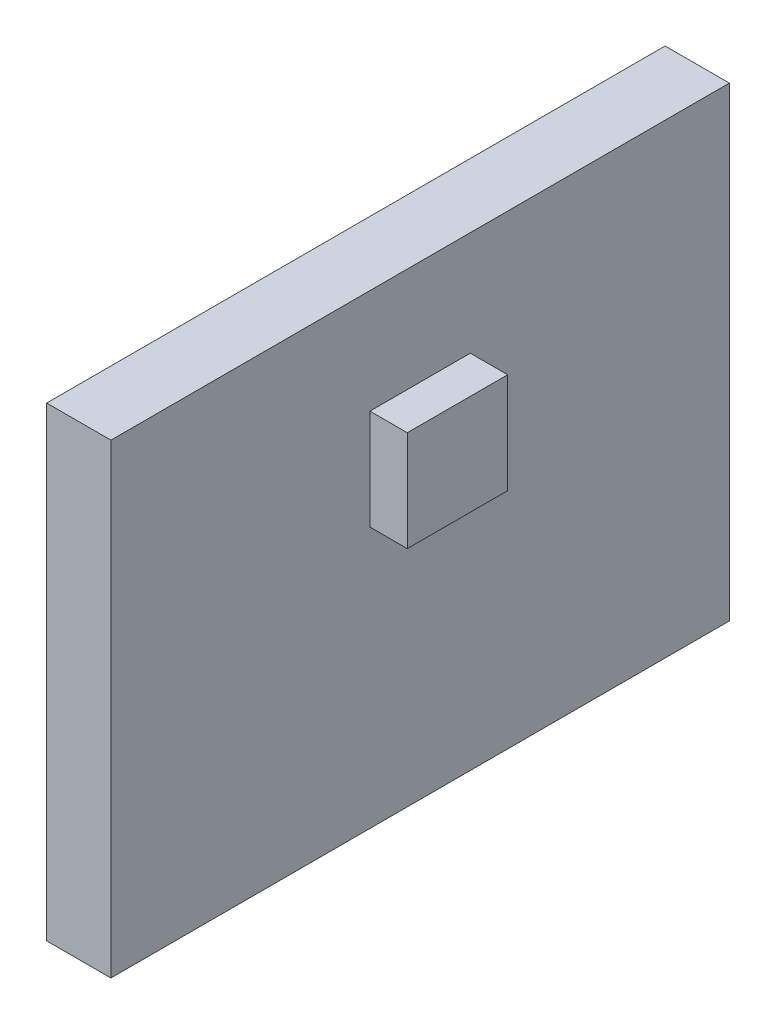
from build123d import *

# Parameters (mm, degrees)
SKETCH1_W           = 1.6
SKETCH1_H           = 11.6
BOSS_EXTRUDE1_DEPTH = 15.4
SKETCH2_W           = 0.93
SKETCH2_H           = 2.5
BOSS_EXTRUDE2_DEPTH = 2.5


with BuildPart() as part:
    # Sketch1 → Boss-Extrude1 (new body)
    with BuildSketch(Plane.XY.offset(18.3)):
        with Locations((-44, -126.7)):
            Rectangle(SKETCH1_W, SKETCH1_H)
    extrude(amount=BOSS_EXTRUDE1_DEPTH)

    # Sketch2 → Boss-Extrude2 (add)
    with BuildSketch(Plane.XY.offset(24.75)):
        with Locations((-42.735, -124.75)):
            Rectangle(SKETCH2_W, SKETCH2_H)
    extrude(amount=BOSS_EXTRUDE2_DEPTH)


solid = part.part
